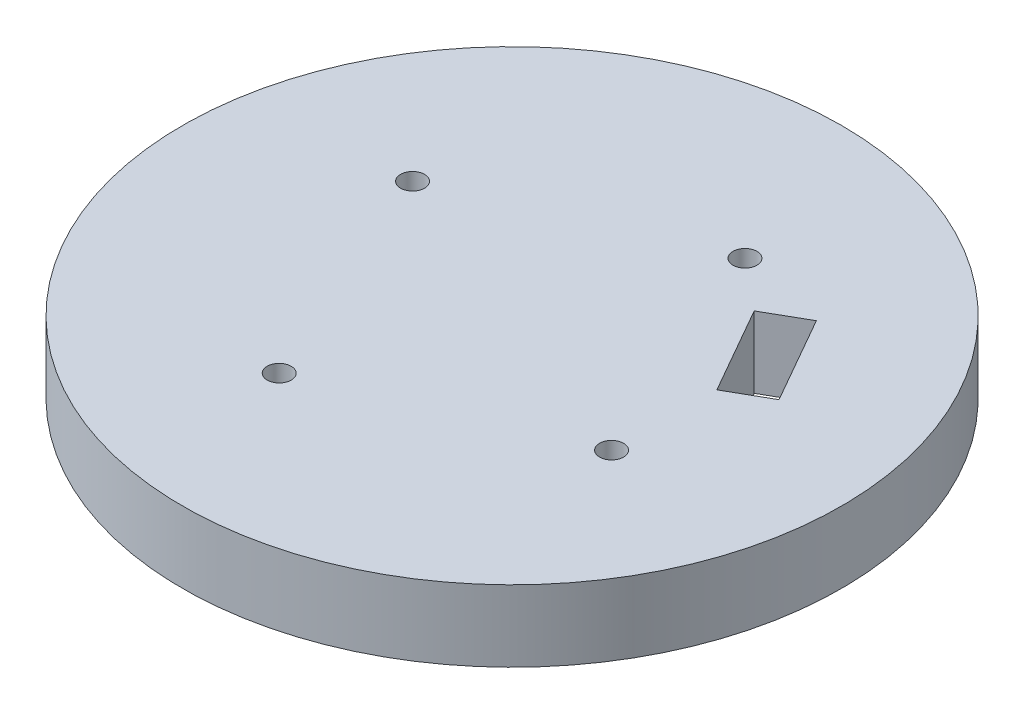
from build123d import *

# Parameters (mm, degrees)
CROQUIS1_R              = 27.5
SALIENTE_EXTRUIR1_DEPTH = 20
CROQUIS3_R              = 5.5
CORTAR_EXTRUIR1_DEPTH   = 10
CROQUIS4_R              = 2
CORTAR_EXTRUIR2_DEPTH   = 10
CROQUIS5_R              = 60
SALIENTE_EXTRUIR2_DEPTH = 13
CORTAR_EXTRUIR3_DEPTH   = 92.043945433
CROQUIS7_R              = 2.186456698
CORTAR_EXTRUIR4_DEPTH   = 88.177978871


with BuildPart() as part:
    # Croquis1 → Saliente-Extruir1 (new body)
    with BuildSketch(Plane(origin=(0, 0, 0), x_dir=(1, 0, 0), z_dir=(0, 1, 0))):
        with Locations(Location((0, 0, 0), (0, 0, 270))):
            Circle(CROQUIS1_R)
    extrude(amount=SALIENTE_EXTRUIR1_DEPTH)

    # Croquis3 → Cortar-Extruir1 (cut)
    with BuildSketch(Plane(origin=(0, 20, 0), x_dir=(1, 0, 0), z_dir=(0, 1, 0))):
        with Locations(Location((0, 0, 0), (0, 0, 270))):
            Circle(CROQUIS3_R)
    extrude(amount=-CORTAR_EXTRUIR1_DEPTH, mode=Mode.SUBTRACT)

    # Croquis4 → Cortar-Extruir2 (cut)
    with BuildSketch(Plane.XZ):
        with Locations(Location((12.224300889, -15.829291449, 0), (0, 0, 270))):
            Circle(CROQUIS4_R)
        with Locations(Location((-15.829291449, -12.224300889, 0), (0, 0, 270))):
            Circle(CROQUIS4_R)
        with Locations(Location((-12.224300889, 15.829291449, 0), (0, 0, 270))):
            Circle(CROQUIS4_R)
        with Locations(Location((15.829291449, 12.224300889, 0), (0, 0, 270))):
            Circle(CROQUIS4_R)
    extrude(amount=-CORTAR_EXTRUIR2_DEPTH, mode=Mode.SUBTRACT)

    # Croquis5 → Saliente-Extruir2 (add)
    with BuildSketch(Plane(origin=(0, 20, 0), x_dir=(1, 0, 0), z_dir=(0, 1, 0))):
        with Locations(Location((0, 0, 0), (0, 0, 90))):
            Circle(CROQUIS5_R)
    extrude(amount=SALIENTE_EXTRUIR2_DEPTH)

    # Croquis6 → Cortar-Extruir3 (cut, through all)
    with BuildSketch(Plane(origin=(0, 33, 0), x_dir=(1, 0, 0), z_dir=(0, 1, 0))):
        Polygon((28.483293317, 26.915833338), (21.280272026, 22.80257149), (30.330623274, 6.953866704), (37.533644565, 11.067128551), align=None)
    extrude(amount=-CORTAR_EXTRUIR3_DEPTH, mode=Mode.SUBTRACT)

    # Croquis7 → Cortar-Extruir4 (cut, through all)
    with BuildSketch(Plane.XZ.offset(-20)):
        with Locations(Location((-30.256887418, -12.141762544, 0), (0, 0, 270))):
            Circle(CROQUIS7_R)
        with Locations(Location((-12.141762544, 30.256887418, 0), (0, 0, 270))):
            Circle(CROQUIS7_R)
        with Locations(Location((30.256887418, 12.141762544, 0), (0, 0, 270))):
            Circle(CROQUIS7_R)
        with Locations(Location((12.141762544, -30.256887418, 0), (0, 0, 270))):
            Circle(CROQUIS7_R)
    extrude(amount=-CORTAR_EXTRUIR4_DEPTH, mode=Mode.SUBTRACT)


solid = part.part
